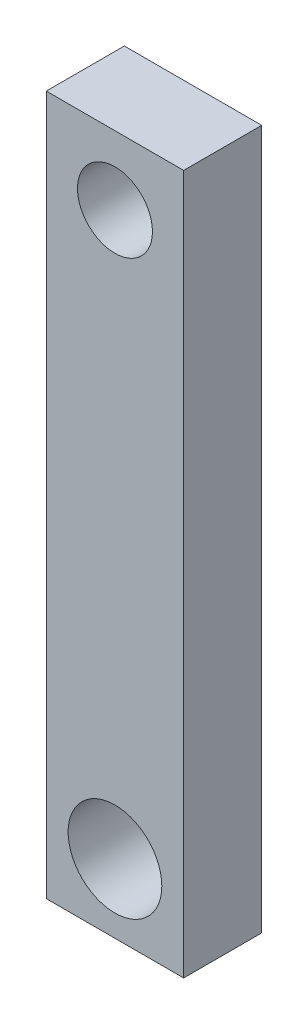
from build123d import *

# Parameters (mm, degrees)
SKETCH1_W           = 44
SKETCH1_H           = 224
SKETCH1_R           = 15
SKETCH1_R_2         = 12
BOSS_EXTRUDE1_DEPTH = 25


with BuildPart() as part:
    # Sketch1 → Boss-Extrude1 (new body)
    with BuildSketch(Plane.XY):
        with Locations((0, 90)):
            Rectangle(SKETCH1_W, SKETCH1_H)
        Circle(SKETCH1_R, mode=Mode.SUBTRACT)
        with Locations((0, 180)):
            Circle(SKETCH1_R_2, mode=Mode.SUBTRACT)
    extrude(amount=BOSS_EXTRUDE1_DEPTH)


solid = part.part
